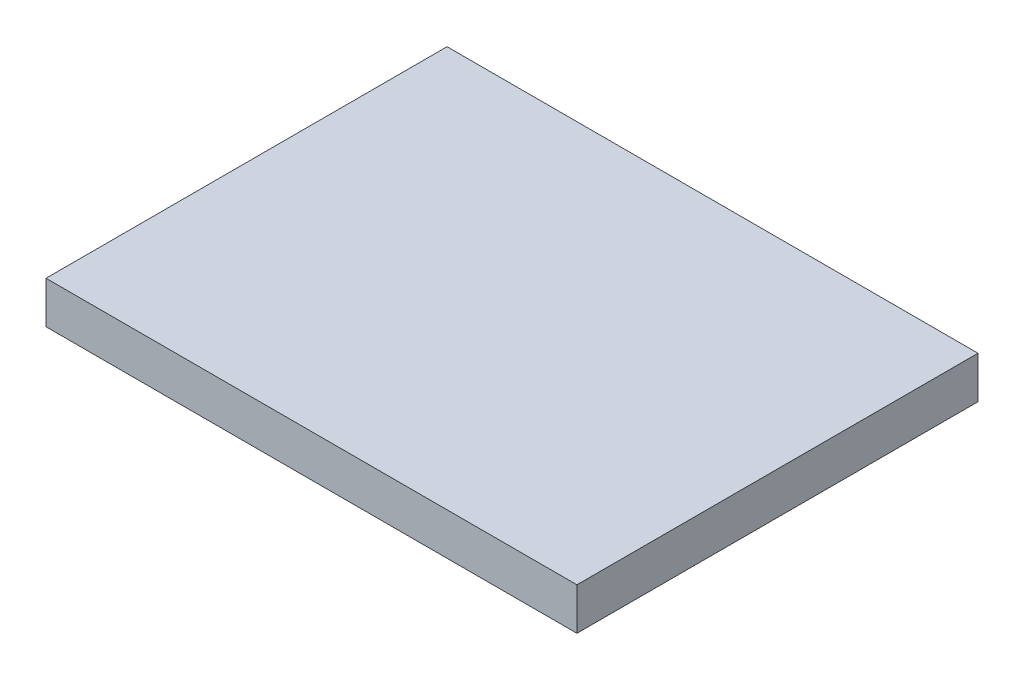
from build123d import *

# Parameters (mm, degrees)
SKETCH1_W           = 176.53
SKETCH1_H           = 133.35
BOSS_EXTRUDE1_DEPTH = 13.97


with BuildPart() as part:
    # Sketch1 → Boss-Extrude1 (new body)
    with BuildSketch(Plane(origin=(0, 0, 0), x_dir=(1, 0, 0), z_dir=(0, 1, 0))):
        Rectangle(SKETCH1_W, SKETCH1_H)
    extrude(amount=BOSS_EXTRUDE1_DEPTH)


solid = part.part
